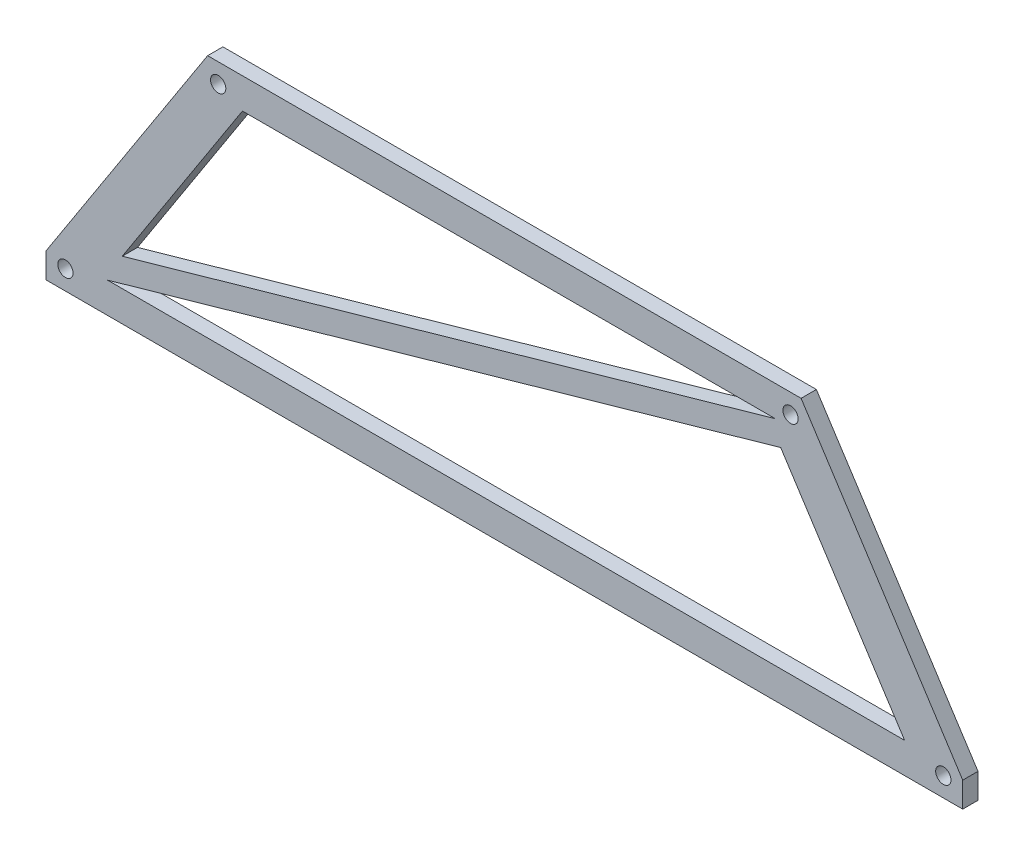
from build123d import *

# Parameters (mm, degrees)
SKETCH1_R           = 5
BOSS_EXTRUDE1_DEPTH = 10
CUT_EXTRUDE1_DEPTH  = 320.43525409


with BuildPart() as part:
    # Sketch1 → Boss-Extrude1 (new body)
    with BuildSketch(Plane.XY):
        Polygon((300, -109.265189129), (300, -92.815809214), (194.210465663, 70.734810871), (-194.210465663, 70.734810871), (-300, -92.815809214), (-300, -109.265189129), align=None)
        with Locations((-187.3, 58.034810871)):
            Circle(SKETCH1_R, mode=Mode.SUBTRACT)
        with Locations((-287.3, -96.565189129)):
            Circle(SKETCH1_R, mode=Mode.SUBTRACT)
        with Locations(Location((287.3, -96.565189129, 0), (0, 0, 180))):
            Circle(SKETCH1_R, mode=Mode.SUBTRACT)
        with Locations(Location((187.3, 58.034810871, 0), (0, 0, 180))):
            Circle(SKETCH1_R, mode=Mode.SUBTRACT)
    extrude(amount=BOSS_EXTRUDE1_DEPTH)

    # Sketch2 → Cut-Extrude1 (cut, through all)
    with BuildSketch(Plane.XY.offset(10)):
        Polygon((180.863413893, 36.132549959), (261.974499978, -89.265189129), (-259.820043515, -89.265189129), align=None)
        Polygon((-250.097346147, -70.903109306), (177.373034147, 50.734810871), (-171.418225722, 50.734810871), align=None)
    extrude(amount=-CUT_EXTRUDE1_DEPTH, mode=Mode.SUBTRACT)


solid = part.part
